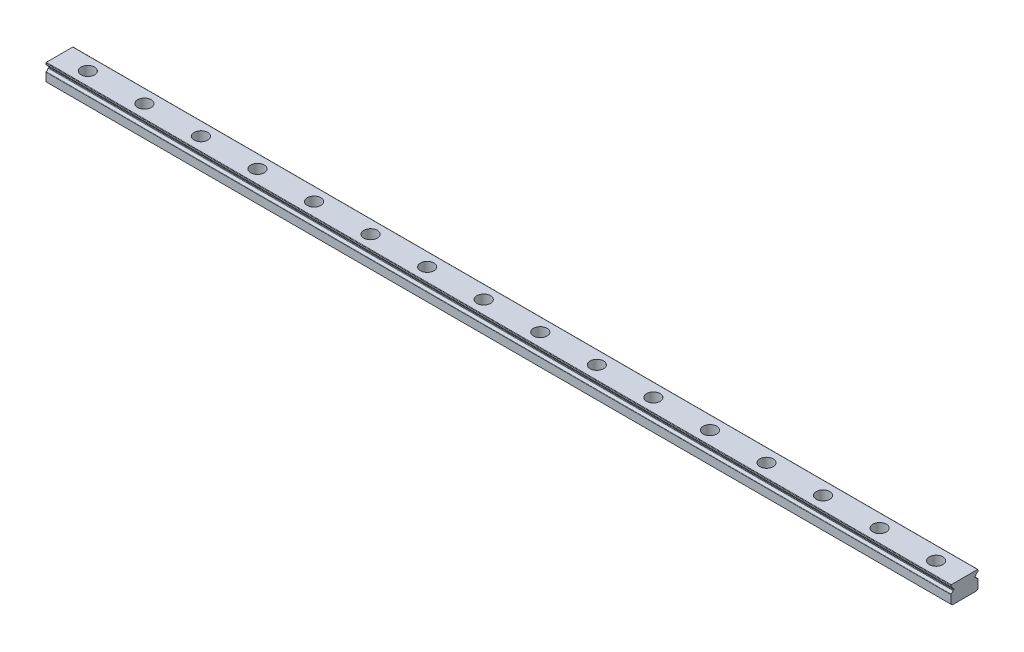
from build123d import *

# Parameters (mm, degrees)
SKETCH_1_W                   = 400
SKETCH_1_H                   = 12
EXTRUDE_1_DEPTH              = 8
CUT_EXTRUDE_1_DEPTH          = 401.06499472
CUT_EXTRUDE_2_DEPTH          = 401.06499472
CUT_EXTRUDE_3_DEPTH          = 401.06499472
CUT_EXTRUDE_4_DEPTH          = 401.06499472
CUT_EXTRUDE_5_DEPTH          = 401.06499472
CUT_EXTRUDE_6_DEPTH          = 401.06499472
HOLE_WIZARD_M3_1_D           = 3.5
HOLE_WIZARD_M3_1_CBORE_D     = 5.9999
HOLE_WIZARD_M3_1_CBORE_DEPTH = 4.5
CHAMFER_1_SIZE               = 0.6
FILLET_1_R                   = 0.2


with BuildPart() as part:
    # 草图1 → 凸台-拉伸1 (new body)
    with BuildSketch(Plane(origin=(0, 4, 0), x_dir=(1, 0, 0), z_dir=(0, 1, 0))):
        Rectangle(SKETCH_1_W, SKETCH_1_H)
    extrude(amount=-EXTRUDE_1_DEPTH)

    # 草图2 → 切除-拉伸1 (cut, through all)
    with BuildSketch(Plane(origin=(200, 0, 0), x_dir=(0, 0, -1), z_dir=(1, 0, 0))):
        with BuildLine():
            Line((6, 1.51), (6, 2.01))
            Line((6, 2.01), (4.8, 2.01))
            ThreePointArc((4.8, 2.01), (4.55, 1.76), (4.8, 1.51))
            Line((4.8, 1.51), (6, 1.51))
        make_face()
    extrude(amount=-CUT_EXTRUDE_1_DEPTH, mode=Mode.SUBTRACT)

    # 草图3 → 切除-拉伸2 (cut, through all)
    with BuildSketch(Plane(origin=(200, 0, 0), x_dir=(0, 0, -1), z_dir=(1, 0, 0))):
        with BuildLine():
            Line((6, 2.01), (6, 3.111111))
            ThreePointArc((6, 3.111111), (5.367595703, 2.693428684), (5.04, 2.01))
            Line((5.04, 2.01), (6, 2.01))
        make_face()
    extrude(amount=-CUT_EXTRUDE_2_DEPTH, mode=Mode.SUBTRACT)

    # 草图4 → 切除-拉伸3 (cut, through all)
    with BuildSketch(Plane(origin=(200, 0, 0), x_dir=(0, 0, -1), z_dir=(1, 0, 0))):
        with BuildLine():
            Line((6, 1.51), (5.04, 1.51))
            ThreePointArc((5.04, 1.51), (5.367595703, 0.826571316), (6, 0.408889))
            Line((6, 0.408889), (6, 1.51))
        make_face()
    extrude(amount=-CUT_EXTRUDE_3_DEPTH, mode=Mode.SUBTRACT)

    # 草图5 → 切除-拉伸4 (cut, through all)
    with BuildSketch(Plane(origin=(200, 0, 0), x_dir=(0, 0, -1), z_dir=(1, 0, 0))):
        with BuildLine():
            Line((-6, 2.01), (-6, 1.51))
            Line((-6, 1.51), (-4.8, 1.51))
            ThreePointArc((-4.8, 1.51), (-4.55, 1.76), (-4.8, 2.01))
            Line((-4.8, 2.01), (-6, 2.01))
        make_face()
    extrude(amount=-CUT_EXTRUDE_4_DEPTH, mode=Mode.SUBTRACT)

    # 草图6 → 切除-拉伸5 (cut, through all)
    with BuildSketch(Plane(origin=(200, 0, 0), x_dir=(0, 0, -1), z_dir=(1, 0, 0))):
        with BuildLine():
            Line((-6, 1.51), (-6, 0.408889))
            ThreePointArc((-6, 0.408889), (-5.367595703, 0.826571316), (-5.04, 1.51))
            Line((-5.04, 1.51), (-6, 1.51))
        make_face()
    extrude(amount=-CUT_EXTRUDE_5_DEPTH, mode=Mode.SUBTRACT)

    # 草图7 → 切除-拉伸6 (cut, through all)
    with BuildSketch(Plane(origin=(200, 0, 0), x_dir=(0, 0, -1), z_dir=(1, 0, 0))):
        with BuildLine():
            Line((-6, 2.01), (-5.04, 2.01))
            ThreePointArc((-5.04, 2.01), (-5.367595703, 2.693428684), (-6, 3.111111))
            Line((-6, 3.111111), (-6, 2.01))
        make_face()
    extrude(amount=-CUT_EXTRUDE_6_DEPTH, mode=Mode.SUBTRACT)

    # M3 六角头机械螺钉的柱形沉头孔1 (through all)
    with Locations(Plane(origin=(0, 4, 0), x_dir=(1, 0, 0), z_dir=(0, 1, 0))):
        with Locations((-187.5, 0), (-162.5, 0), (-137.5, 0), (-112.5, 0), (-87.5, 0), (-62.5, 0), (-37.5, 0), (-12.5, 0), (12.5, 0), (37.5, 0), (62.5, 0), (87.5, 0), (112.5, 0), (137.5, 0), (162.5, 0), (187.5, 0)):
            CounterBoreHole(HOLE_WIZARD_M3_1_D / 2, HOLE_WIZARD_M3_1_CBORE_D / 2, HOLE_WIZARD_M3_1_CBORE_DEPTH)

    # 倒角1
    chamfer_1_edges = [part.edges().sort_by_distance(p)[0] for p in [
        (0, -4, -6),
        (0, -4, 6),
    ]]
    chamfer(chamfer_1_edges, length=CHAMFER_1_SIZE)

    # 圆角1
    fillet_1_edges = [part.edges().sort_by_distance(p)[0] for p in [
        (0, 2.01, -5.04),
        (0, 3.111111, -6),
        (0, 0.408889, -6),
        (0, 1.51, -5.04),
        (0, 4, -6),
        (0, 4, 6),
        (0, 1.51, 5.04),
        (0, 0.408889, 6),
        (0, 3.111111, 6),
        (0, 2.01, 5.04),
    ]]
    fillet(fillet_1_edges, radius=FILLET_1_R)


solid = part.part
